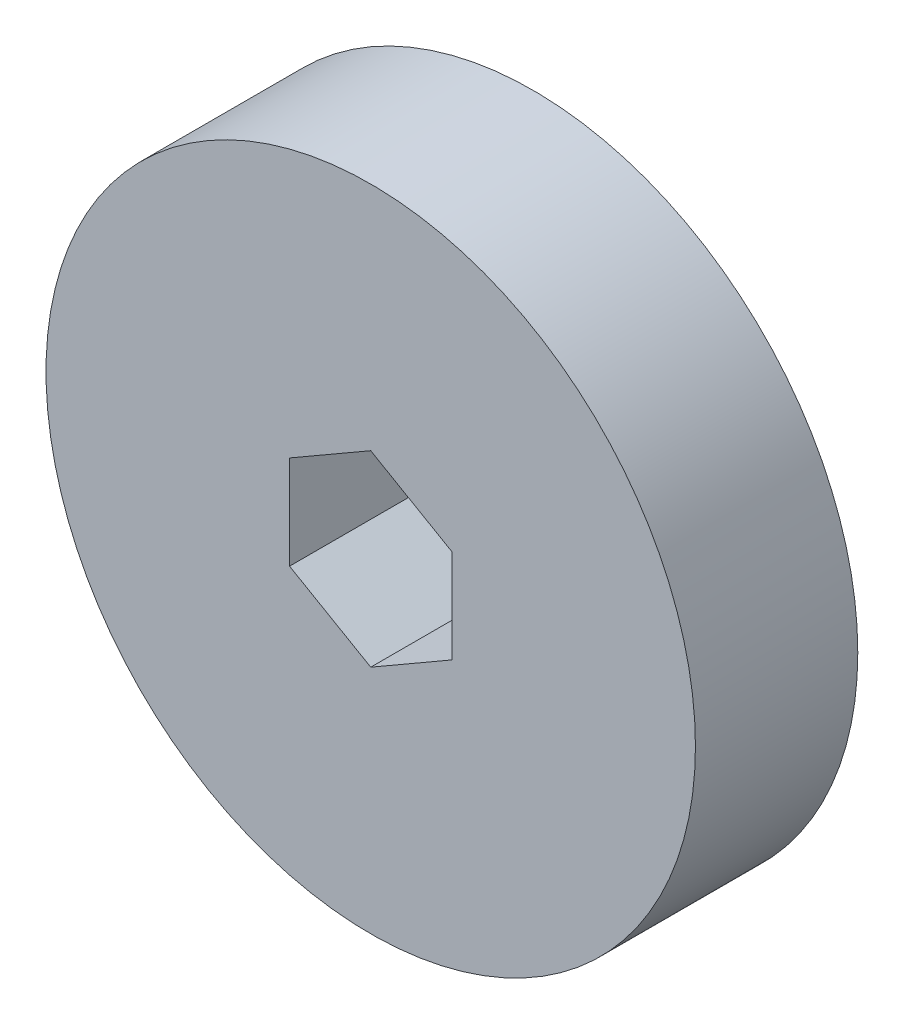
from build123d import *

# Parameters (mm, degrees)
SKETCH1_R           = 6.35
BOSS_EXTRUDE1_DEPTH = 3.175


with BuildPart() as part:
    # Sketch1 → Boss-Extrude1 (new body)
    with BuildSketch(Plane.XY):
        Circle(SKETCH1_R)
        Polygon((0, -1.833087105), (1.5875, -0.916543552), (1.5875, 0.916543552), (0, 1.833087105), (-1.5875, 0.916543552), (-1.5875, -0.916543552), align=None, mode=Mode.SUBTRACT)
    extrude(amount=BOSS_EXTRUDE1_DEPTH)


solid = part.part
